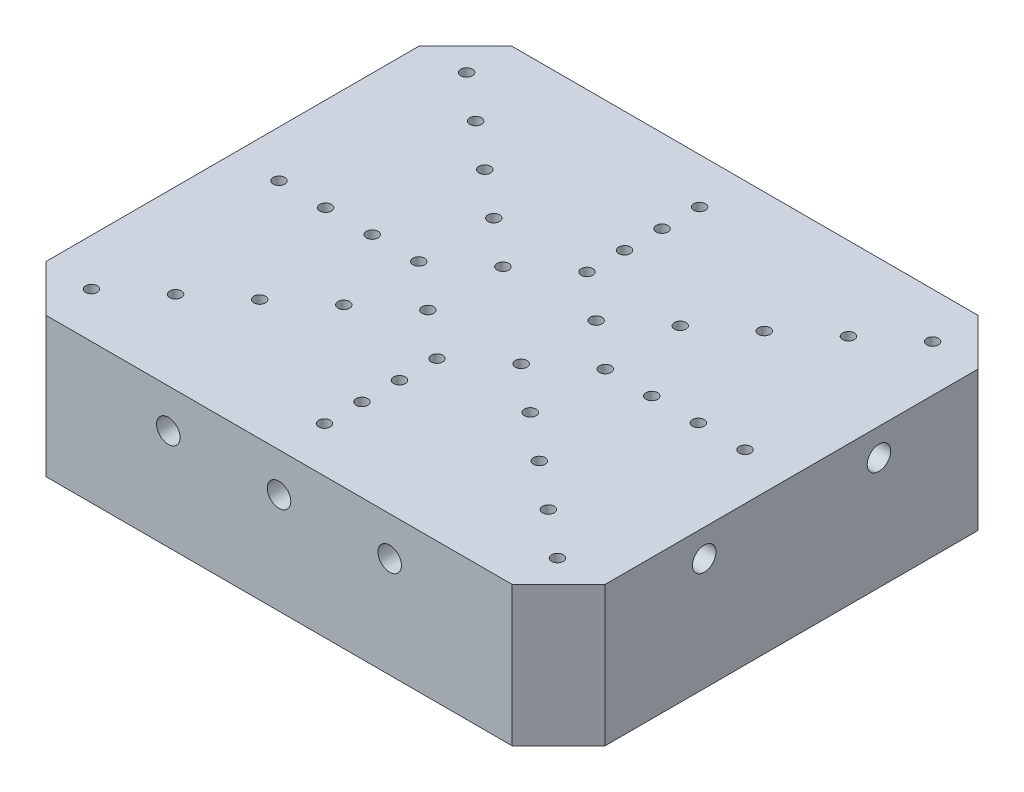
from build123d import *

# Parameters (mm, degrees)
SKETCH1_W                = 240
SKETCH1_H                = 200
BOSS_EXTRUDE1_DEPTH      = 60
CHAMFER1_SIZE            = 20
CUT_EXTRUDE1_DEPTH       = 56
SKETCH21_R               = 2.5
CUT_EXTRUDE16_DEPTH      = 54
CUT_EXTRUDE17_DEPTH      = 312.92947921
CUT_EXTRUDE17_DEPTH_BACK = 312.92947921
SKETCH24_R               = 5.05
CUT_EXTRUDE18_DEPTH      = 311.64449134
CUT_EXTRUDE18_DEPTH_BACK = 311.64449134
SKETCH27_R               = 5.05
SKETCH30_R               = 5
BOSS_EXTRUDE2_DEPTH      = 8.53


with BuildPart() as part:
    # Sketch1 → Boss-Extrude1 (new body)
    with BuildSketch(Plane(origin=(0, 0, 0), x_dir=(1, 0, 0), z_dir=(0, 1, 0))):
        with Locations((120, 100)):
            Rectangle(SKETCH1_W, SKETCH1_H)
    extrude(amount=BOSS_EXTRUDE1_DEPTH)

    # Chamfer1
    chamfer1_edges = [part.edges().sort_by_distance(p)[0] for p in [
        (0, 30, -200),
        (240, 30, -200),
        (240, 30, 0),
        (0, 30, 0),
    ]]
    chamfer(chamfer1_edges, length=CHAMFER1_SIZE)

    # Sketch2 → Cut-Extrude1 (cut)
    with BuildSketch(Plane.XZ):
        Polygon((10, -175), (10, -25), (25, -10), (215, -10), (230, -25), (230, -175), (215, -190), (25, -190), align=None)
    extrude(amount=-CUT_EXTRUDE1_DEPTH, mode=Mode.SUBTRACT)

    # Sketch21 → Cut-Extrude16 (cut)
    with BuildSketch(Plane.XZ.offset(-56)):
        with Locations(Location((20, -19.512195122, 0), (0, 0, 270))):
            Circle(SKETCH21_R)
        with Locations(Location((40, -35.609756098, 0), (0, 0, 270))):
            Circle(SKETCH21_R)
        with Locations(Location((60, -51.707317073, 0), (0, 0, 270))):
            Circle(SKETCH21_R)
        with Locations(Location((80, -67.804878049, 0), (0, 0, 270))):
            Circle(SKETCH21_R)
        with Locations(Location((100, -83.902439024, 0), (0, 0, 270))):
            Circle(SKETCH21_R)
        with Locations(Location((120, -19.512195122, 0), (0, 0, 270))):
            Circle(SKETCH21_R)
        with Locations(Location((120, -35.609756098, 0), (0, 0, 270))):
            Circle(SKETCH21_R)
        with Locations(Location((120, -51.707317073, 0), (0, 0, 270))):
            Circle(SKETCH21_R)
        with Locations(Location((120, -67.804878049, 0), (0, 0, 270))):
            Circle(SKETCH21_R)
        with Locations(Location((140, -83.902439024, 0), (0, 0, 270))):
            Circle(SKETCH21_R)
        with Locations(Location((160, -67.804878049, 0), (0, 0, 270))):
            Circle(SKETCH21_R)
        with Locations(Location((180, -51.707317073, 0), (0, 0, 270))):
            Circle(SKETCH21_R)
        with Locations(Location((200, -35.609756098, 0), (0, 0, 270))):
            Circle(SKETCH21_R)
        with Locations(Location((220, -19.512195122, 0), (0, 0, 270))):
            Circle(SKETCH21_R)
        with Locations(Location((220, -100, 0), (0, 0, 270))):
            Circle(SKETCH21_R)
        with Locations(Location((200, -100, 0), (0, 0, 270))):
            Circle(SKETCH21_R)
        with Locations(Location((180, -100, 0), (0, 0, 270))):
            Circle(SKETCH21_R)
        with Locations(Location((160, -100, 0), (0, 0, 270))):
            Circle(SKETCH21_R)
        with Locations(Location((140, -116.097560976, 0), (0, 0, 270))):
            Circle(SKETCH21_R)
        with Locations(Location((160, -132.195121951, 0), (0, 0, 270))):
            Circle(SKETCH21_R)
        with Locations(Location((180, -148.292682927, 0), (0, 0, 270))):
            Circle(SKETCH21_R)
        with Locations(Location((200, -164.390243902, 0), (0, 0, 270))):
            Circle(SKETCH21_R)
        with Locations(Location((220, -180.487804878, 0), (0, 0, 270))):
            Circle(SKETCH21_R)
        with Locations(Location((120, -180.487804878, 0), (0, 0, 270))):
            Circle(SKETCH21_R)
        with Locations(Location((120, -164.390243902, 0), (0, 0, 270))):
            Circle(SKETCH21_R)
        with Locations(Location((120, -148.292682927, 0), (0, 0, 270))):
            Circle(SKETCH21_R)
        with Locations(Location((120, -132.195121951, 0), (0, 0, 270))):
            Circle(SKETCH21_R)
        with Locations(Location((100, -116.097560976, 0), (0, 0, 270))):
            Circle(SKETCH21_R)
        with Locations(Location((80, -132.195121951, 0), (0, 0, 270))):
            Circle(SKETCH21_R)
        with Locations(Location((60, -148.292682927, 0), (0, 0, 270))):
            Circle(SKETCH21_R)
        with Locations(Location((40, -164.390243902, 0), (0, 0, 270))):
            Circle(SKETCH21_R)
        with Locations(Location((20, -180.487804878, 0), (0, 0, 270))):
            Circle(SKETCH21_R)
        with Locations(Location((20, -100, 0), (0, 0, 270))):
            Circle(SKETCH21_R)
        with Locations(Location((40, -100, 0), (0, 0, 270))):
            Circle(SKETCH21_R)
        with Locations(Location((60, -100, 0), (0, 0, 270))):
            Circle(SKETCH21_R)
        with Locations(Location((80, -100, 0), (0, 0, 270))):
            Circle(SKETCH21_R)
    extrude(amount=-CUT_EXTRUDE16_DEPTH, mode=Mode.SUBTRACT)

    # Sketch24 → Cut-Extrude17 (cut, two sides: drawn at the far end of the back side and taken through both)
    with BuildSketch(Plane.XY.offset(-190).offset(-CUT_EXTRUDE17_DEPTH_BACK)):
        with Locations((120, 43.3)):
            Circle(SKETCH24_R)
        with Locations((72.5, 43.3)):
            Circle(SKETCH24_R)
        with Locations((167.5, 43.3)):
            Circle(SKETCH24_R)
    extrude(amount=CUT_EXTRUDE17_DEPTH + CUT_EXTRUDE17_DEPTH_BACK, mode=Mode.SUBTRACT)

    # Sketch27 → Cut-Extrude18 (cut, two sides: drawn at the far end of the back side and taken through both)
    with BuildSketch(Plane(origin=(10, 0, 0), x_dir=(0, 0, -1), z_dir=(1, 0, 0)).offset(-CUT_EXTRUDE18_DEPTH_BACK)):
        with Locations((62.5, 48.3)):
            Circle(SKETCH27_R)
        with Locations((137.5, 48.3)):
            Circle(SKETCH27_R)
    extrude(amount=CUT_EXTRUDE18_DEPTH + CUT_EXTRUDE18_DEPTH_BACK, mode=Mode.SUBTRACT)


with BuildPart() as body_2:
    # Sketch30 → Boss-Extrude2 (new body)
    with BuildSketch(Plane.XZ.offset(-56)):
        with Locations(Location((200, -35.609756098, 0), (0, 0, 270))):
            Circle(SKETCH30_R)
    extrude(amount=BOSS_EXTRUDE2_DEPTH)


solid = Compound([part.part, body_2.part])
